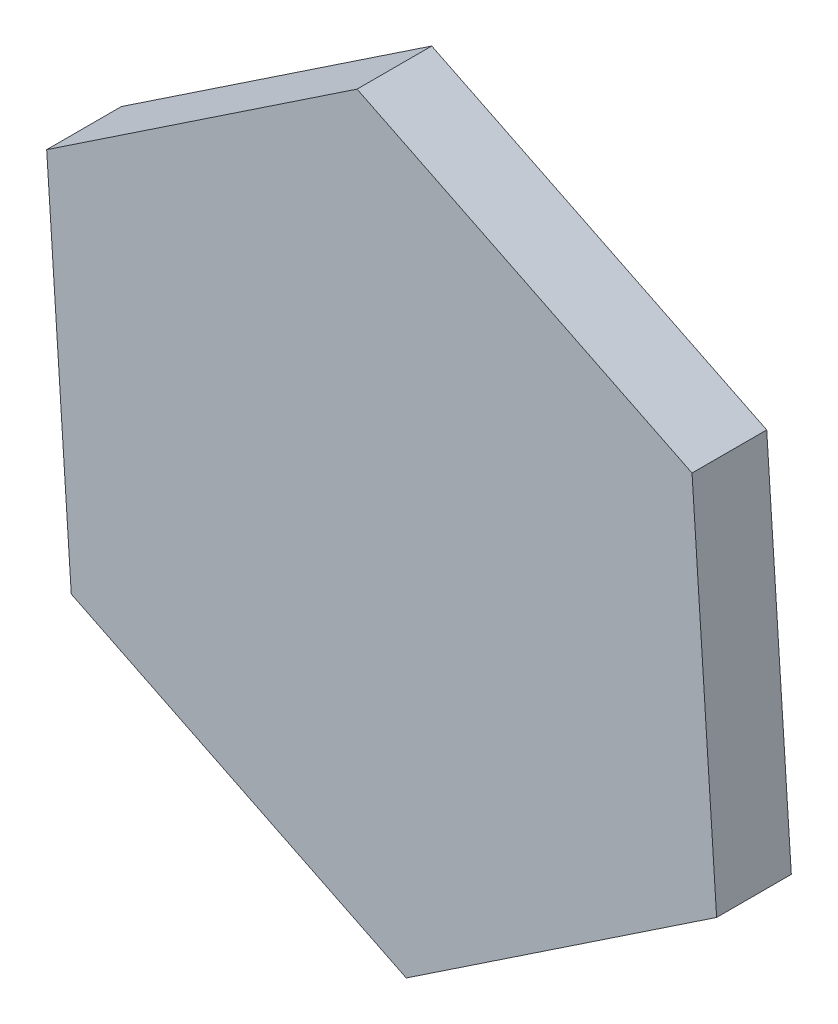
from build123d import *

# Parameters (mm, degrees)
BOSS_EXTRU_1_DEPTH = 15


with BuildPart() as part:
    # Esquisse1 → Boss.-Extru.1 (new body)
    with BuildSketch(Plane.XY):
        Polygon((62.339416891, 41.698886097), (-4.942586224, 74.836961733), (-67.282003115, 33.138075636), (-62.339416891, -41.698886097), (4.942586224, -74.836961733), (67.282003115, -33.138075636), align=None)
    extrude(amount=BOSS_EXTRU_1_DEPTH)


solid = part.part
